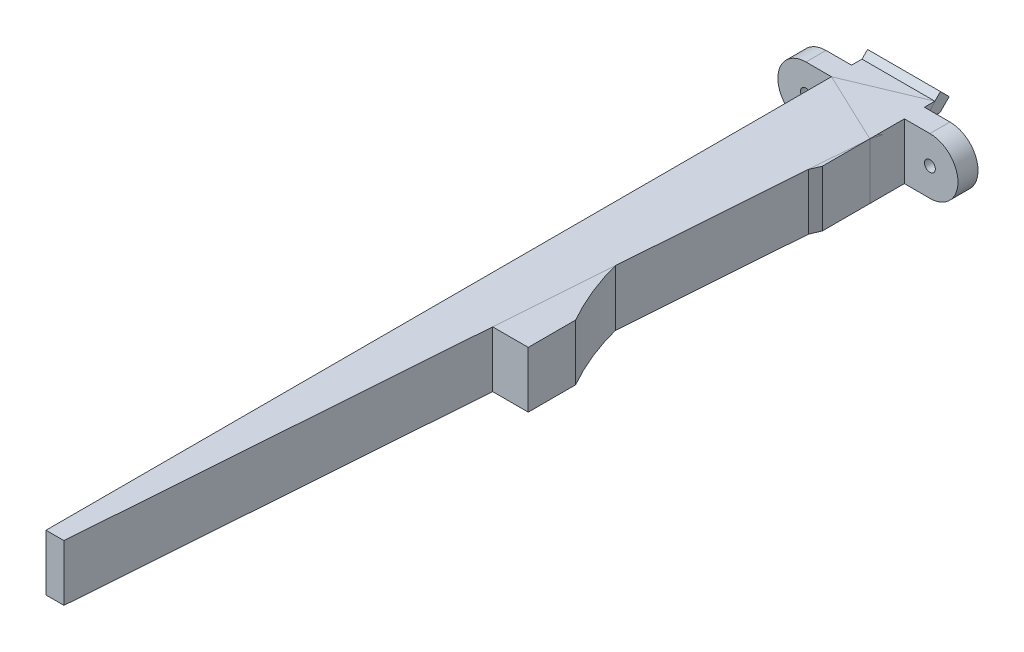
from build123d import *

# Parameters (mm, degrees)
SKETCH2_W           = 10
SKETCH2_H           = 14.768412439
BOSS_EXTRUDE1_DEPTH = 5
BOSS_EXTRUDE4_DEPTH = 10
SKETCH9_W           = 10
SKETCH9_H           = 3.18
SKETCH9_H_2         = 3.888412439
CUT_EXTRUDE3_DEPTH  = 5
BOSS_EXTRUDE5_DEPTH = 7.7
SKETCH12_R          = 0.75
BOSS_EXTRUDE7_DEPTH = 2.75
FILLET1_R           = 2.5
SKETCH13_W          = 13.67386451
SKETCH13_H          = 47.62797089
CUT_EXTRUDE4_DEPTH  = 100
SKETCH14_W          = 10
SKETCH14_H          = 7.7
BOSS_EXTRUDE8_DEPTH = 100
CUT_EXTRUDE5_DEPTH  = 100


with BuildPart() as part:
    # Sketch2 → Boss-Extrude1 (new body)
    with BuildSketch(Plane.XY):
        with Locations((0, 1.566049366)):
            Rectangle(SKETCH2_W, SKETCH2_H)
    extrude(amount=BOSS_EXTRUDE1_DEPTH)

    # Sketch8 → Boss-Extrude4 (add)
    with BuildSketch(Plane.ZY.offset(5)):
        Polygon((-0.15, 5.770255585), (0, 5.770255585), (0, 4.070255585), (-0.15, 4.070255585), (-2.137867966, 4.070255585), (-3.402081528, 5.334469147), (-2.2, 6.536550675), (-1.43370491, 5.770255585), align=None)
        Polygon((-0.15, -1.929744415), (0, -1.929744415), (0, -0.229744415), (-0.15, -0.229744415), (-1.43370491, -0.229744415), (-2.2, 0.536550675), (-3.402081528, -0.665530853), (-2.137867966, -1.929744415), align=None)
    extrude(amount=-BOSS_EXTRUDE4_DEPTH)

    # Sketch9 → Cut-Extrude3 (cut)
    with BuildSketch(Plane(origin=(0, 0, 0), x_dir=(-1, 0, 0), z_dir=(0, 0, -1))):
        with Locations((0, 7.360255585)):
            Rectangle(SKETCH9_W, SKETCH9_H)
        with Locations((0, -3.873950635)):
            Rectangle(SKETCH9_W, SKETCH9_H_2)
    extrude(amount=-CUT_EXTRUDE3_DEPTH, mode=Mode.SUBTRACT)

    # Sketch10 → Boss-Extrude5 (add)
    with BuildSketch(Plane(origin=(0, 5.770255585, 0), x_dir=(1, 0, 0), z_dir=(0, 1, 0))):
        with BuildLine():
            Line((-5, -5), (-5, -10.5))
            Line((-5, -10.5), (1.352445729, -55.7))
            Line((1.352445729, -55.7), (6.352445729, -55.7))
            Line((6.352445729, -55.7), (6.352445729, -49.2))
            ThreePointArc((6.352445729, -49.2), (1.383429579, -31.764936646), (5, -14))
            Line((5, -14), (5, -5))
            Line((5, -5), (-5, -5))
        make_face()
    extrude(amount=-BOSS_EXTRUDE5_DEPTH)

    # Sketch12 → Boss-Extrude7 (add)
    with BuildSketch(Plane.XY):
        with BuildLine():
            Line((5, 5.770255585), (8.5, 5.770255585))
            ThreePointArc((8.5, 5.770255585), (12.35, 1.920255585), (8.5, -1.929744415))
            Line((8.5, -1.929744415), (5, -1.929744415))
            Line((5, -1.929744415), (5, 5.770255585))
        make_face()
        with Locations((8.5, 1.920255585)):
            Circle(SKETCH12_R, mode=Mode.SUBTRACT)
    extrude(amount=BOSS_EXTRUDE7_DEPTH)


with BuildPart() as body_2:
    # Mirror1: mirrored copy
    add(part.part.mirror(Plane(origin=(0, 0, 0), x_dir=(0, 0, 1), z_dir=(1, 0, 0))))

    # Fillet1
    fillet1_edges = [body_2.edges().sort_by_distance(p)[0] for p in [
        (-6.352445729, 1.920255585, 49.2),
        (-5, 1.920255585, 14),
        (-1.352445729, 1.920255585, 55.7),
        (-6.352445729, 1.920255585, 55.7),
    ]]
    fillet(fillet1_edges, radius=FILLET1_R)

    # Sketch13 → Cut-Extrude4 (cut)
    with BuildSketch(Plane(origin=(0, 5.770255585, 0), x_dir=(1, 0, 0), z_dir=(0, 1, 0))):
        with Locations((-1.836932255, -34.313985445)):
            Rectangle(SKETCH13_W, SKETCH13_H)
    extrude(amount=-CUT_EXTRUDE4_DEPTH, mode=Mode.SUBTRACT)

    # Sketch14 → Boss-Extrude8 (add)
    with BuildSketch(Plane.XY.offset(10.5)):
        with Locations((0, 1.920255585)):
            Rectangle(SKETCH14_W, SKETCH14_H)
    extrude(amount=BOSS_EXTRUDE8_DEPTH)

    # Sketch15 → Cut-Extrude5 (cut)
    with BuildSketch(Plane(origin=(0, 5.770255585, 0), x_dir=(1, 0, 0), z_dir=(0, 1, 0))):
        Polygon((5, -7.489382654), (-2.538683526, -110.5), (5, -110.5), align=None)
    extrude(amount=-CUT_EXTRUDE5_DEPTH, mode=Mode.SUBTRACT)


solid = Compound([part.part, body_2.part])
